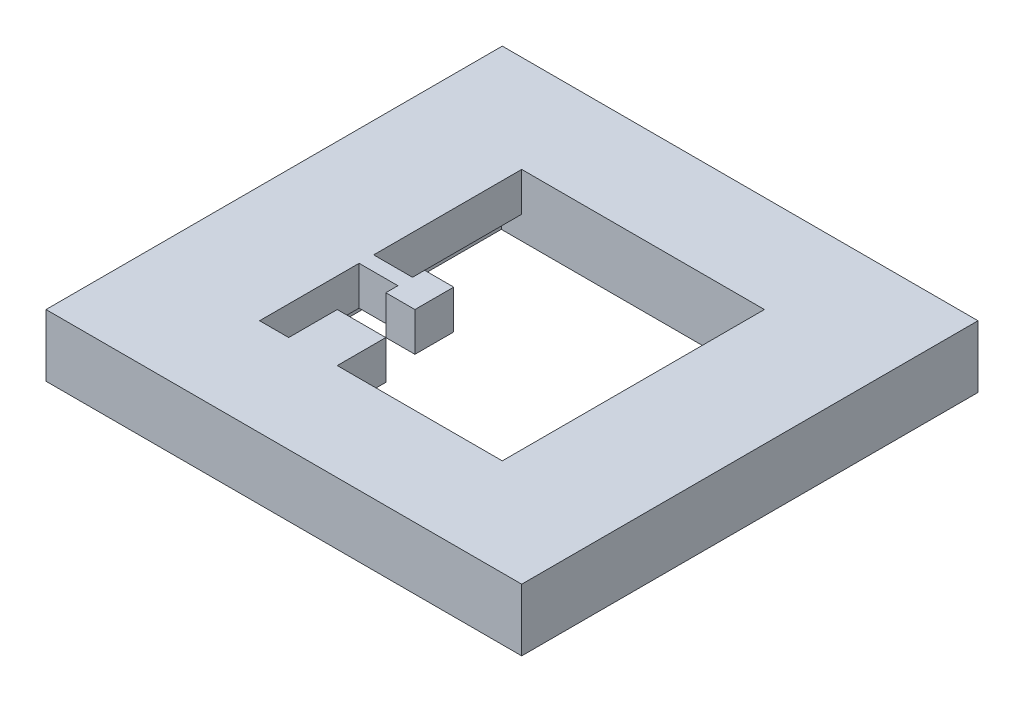
from build123d import *

# Parameters (mm, degrees)
SKETCH1_W           = 49
SKETCH1_H           = 47
BOSS_EXTRUDE1_DEPTH = 4
SKETCH2_W           = 49
SKETCH2_H           = 47
SKETCH2_W_2         = 29.2
SKETCH2_H_2         = 27
BOSS_EXTRUDE2_DEPTH = 2.4


with BuildPart() as part:
    # Sketch1 → Boss-Extrude1 (new body)
    with BuildSketch(Plane(origin=(0, 0, 0), x_dir=(1, 0, 0), z_dir=(0, 1, 0))):
        Rectangle(SKETCH1_W, SKETCH1_H)
        Polygon((-12.5, -13.5), (-9.5, -13.5), (-9.5, -8.5), (-4.5, -8.5), (-4.5, -13.5), (12.5, -13.5), (12.5, 13.5), (-12.5, 13.5), (-12.5, -1.75), (-8.5, -1.75), (-8.5, -0.5), (-5.5, -0.5), (-5.5, -4.5), (-8.5, -4.5), (-8.5, -3.25), (-12.5, -3.25), align=None, mode=Mode.SUBTRACT)
    extrude(amount=BOSS_EXTRUDE1_DEPTH)

    # Sketch2 → Boss-Extrude2 (add)
    with BuildSketch(Plane.XZ):
        Rectangle(SKETCH2_W, SKETCH2_H)
        Rectangle(SKETCH2_W_2, SKETCH2_H_2, mode=Mode.SUBTRACT)
    extrude(amount=BOSS_EXTRUDE2_DEPTH)


solid = part.part
